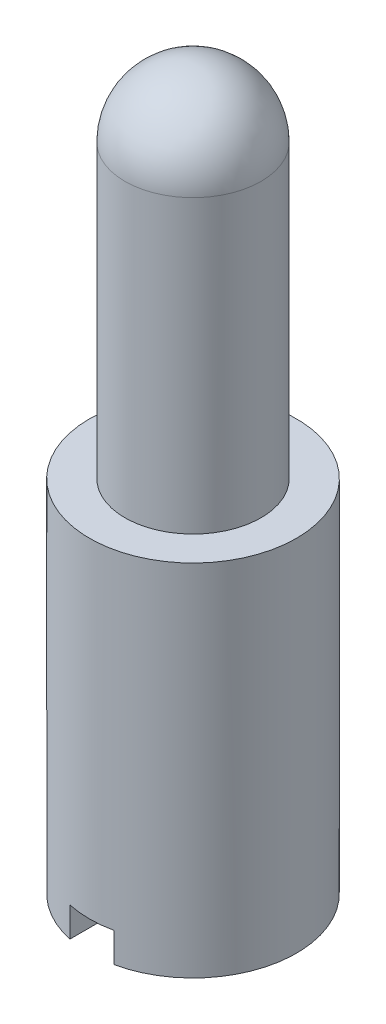
from build123d import *

# Parameters (mm, degrees)
SKETCH2_W          = 1.1684
SKETCH2_H          = 6.165294662
CUT_EXTRUDE1_DEPTH = 0.7874


with BuildPart() as part:
    # Sketch1 → Revolve1 (revolve)
    with BuildSketch(Plane.XY, mode=Mode.PRIVATE) as revolve1_sk:
        with BuildLine():
            Line((0, 19.05), (0, 0))
            Line((0, 0), (2.7432, 0))
            Line((2.7432, 0), (2.7432, 9.525))
            Line((2.7432, 9.525), (1.8034, 9.525))
            Line((1.8034, 9.525), (1.8034, 17.2466))
            ThreePointArc((1.8034, 17.2466), (1.275196369, 18.521796369), (0, 19.05))
        make_face()
    revolve(revolve1_sk.sketch.rotate(Axis((0, 19.05, 0), (0, -1, 0)), 180), axis=Axis((0, 19.05, 0), (0, -1, 0)))

    # Sketch2 → Cut-Extrude1 (cut)
    with BuildSketch(Plane.XZ):
        Rectangle(SKETCH2_W, SKETCH2_H)
    extrude(amount=-CUT_EXTRUDE1_DEPTH, mode=Mode.SUBTRACT)


solid = part.part
